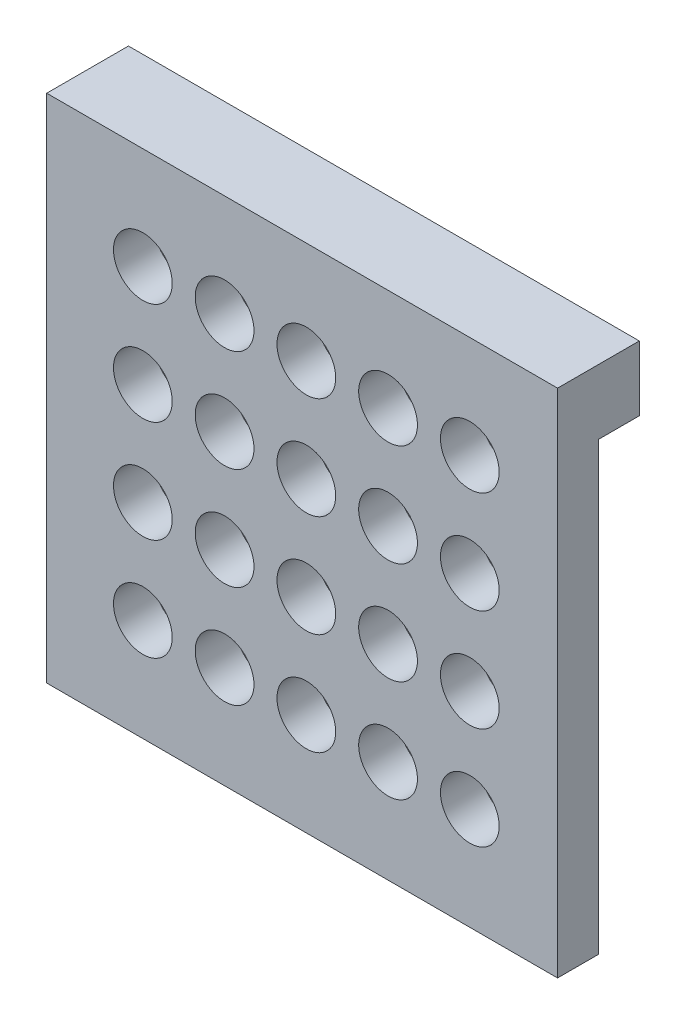
from build123d import *

# Parameters (mm, degrees)
SKETCH1_W           = 50
SKETCH1_H           = 50
BOSS_EXTRUDE1_DEPTH = 4
SKETCH2_R           = 2.874998181
CUT_EXTRUDE1_DEPTH  = 4
SKETCH3_W           = 50
SKETCH3_H           = 6.348267119
BOSS_EXTRUDE2_DEPTH = 4


with BuildPart() as part:
    # Sketch1 → Boss-Extrude1 (new body)
    with BuildSketch(Plane.XY):
        with Locations((25, 25)):
            Rectangle(SKETCH1_W, SKETCH1_H)
    extrude(amount=BOSS_EXTRUDE1_DEPTH)

    # Sketch2 → Cut-Extrude1 (cut)
    with BuildSketch(Plane.XY.offset(4)):
        with Locations((9.410896039, 40.009779151)):
            Circle(SKETCH2_R)
        with Locations((17.410896039, 40.009779151)):
            Circle(SKETCH2_R)
        with Locations((25.410896039, 40.009779151)):
            Circle(SKETCH2_R)
        with Locations((33.410896039, 40.009779151)):
            Circle(SKETCH2_R)
        with Locations((41.410896039, 40.009779151)):
            Circle(SKETCH2_R)
        with Locations((17.410896039, 30.009779151)):
            Circle(SKETCH2_R)
        with Locations((25.410896039, 30.009779151)):
            Circle(SKETCH2_R)
        with Locations((33.410896039, 30.009779151)):
            Circle(SKETCH2_R)
        with Locations((41.410896039, 30.009779151)):
            Circle(SKETCH2_R)
        with Locations((17.410896039, 20.009779151)):
            Circle(SKETCH2_R)
        with Locations((25.410896039, 20.009779151)):
            Circle(SKETCH2_R)
        with Locations((33.410896039, 20.009779151)):
            Circle(SKETCH2_R)
        with Locations((41.410896039, 20.009779151)):
            Circle(SKETCH2_R)
        with Locations((17.410896039, 10.009779151)):
            Circle(SKETCH2_R)
        with Locations((25.410896039, 10.009779151)):
            Circle(SKETCH2_R)
        with Locations((33.410896039, 10.009779151)):
            Circle(SKETCH2_R)
        with Locations((41.410896039, 10.009779151)):
            Circle(SKETCH2_R)
        with Locations((9.410896039, 30.009779151)):
            Circle(SKETCH2_R)
        with Locations((9.410896039, 20.009779151)):
            Circle(SKETCH2_R)
        with Locations((9.410896039, 10.009779151)):
            Circle(SKETCH2_R)
    extrude(amount=-CUT_EXTRUDE1_DEPTH, mode=Mode.SUBTRACT)

    # Sketch3 → Boss-Extrude2 (add)
    with BuildSketch(Plane(origin=(0, 0, 0), x_dir=(-1, 0, 0), z_dir=(0, 0, -1))):
        with Locations((-25, 46.825866441)):
            Rectangle(SKETCH3_W, SKETCH3_H)
    extrude(amount=BOSS_EXTRUDE2_DEPTH)


solid = part.part
